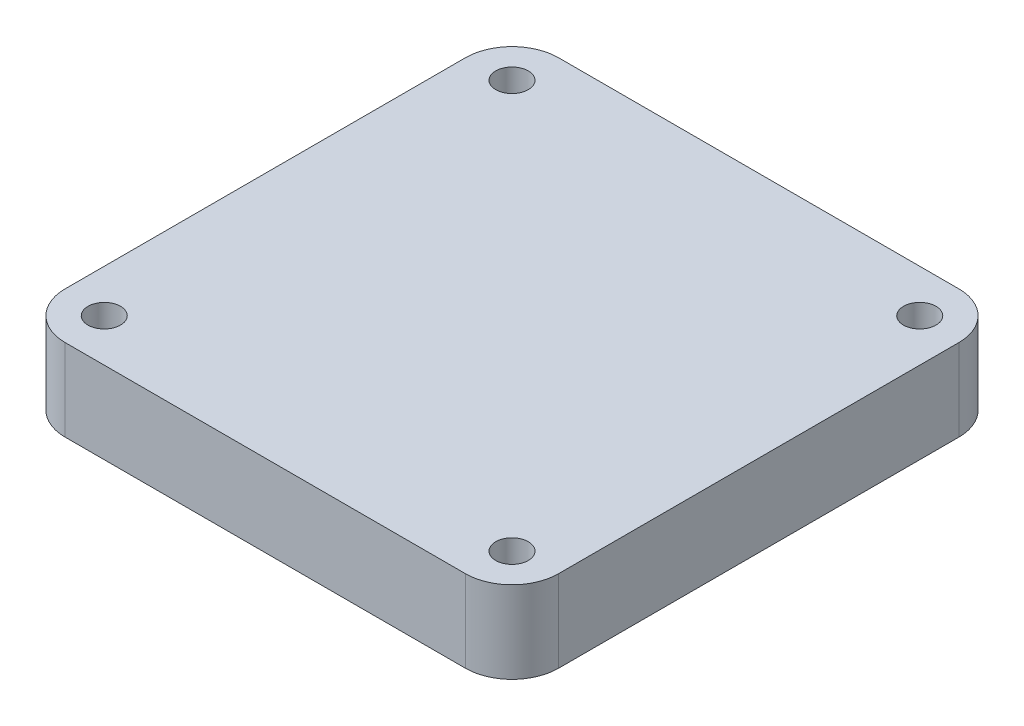
from build123d import *

# Parameters (mm, degrees)
SKETCH1_W           = 53
SKETCH1_H           = 53
SKETCH1_R           = 1.75
BOSS_EXTRUDE1_DEPTH = 8.8
FILLET1_R           = 5


with BuildPart() as part:
    # Sketch1 → Boss-Extrude1 (new body)
    with BuildSketch(Plane(origin=(0, 0, 0), x_dir=(1, 0, 0), z_dir=(0, 1, 0))):
        Rectangle(SKETCH1_W, SKETCH1_H)
        with Locations(Location((-21.9, 21.9, 0), (0, 0, 270))):
            Circle(SKETCH1_R, mode=Mode.SUBTRACT)
        with Locations(Location((21.9, 21.9, 0), (0, 0, 270))):
            Circle(SKETCH1_R, mode=Mode.SUBTRACT)
        with Locations(Location((21.9, -21.9, 0), (0, 0, 270))):
            Circle(SKETCH1_R, mode=Mode.SUBTRACT)
        with Locations(Location((-21.9, -21.9, 0), (0, 0, 270))):
            Circle(SKETCH1_R, mode=Mode.SUBTRACT)
    extrude(amount=BOSS_EXTRUDE1_DEPTH)

    # Fillet1
    fillet1_edges = [part.edges().sort_by_distance(p)[0] for p in [
        (26.5, 4.4, 26.5),
        (-26.5, 4.4, 26.5),
        (-26.5, 4.4, -26.5),
        (26.5, 4.4, -26.5),
    ]]
    fillet(fillet1_edges, radius=FILLET1_R)


solid = part.part
